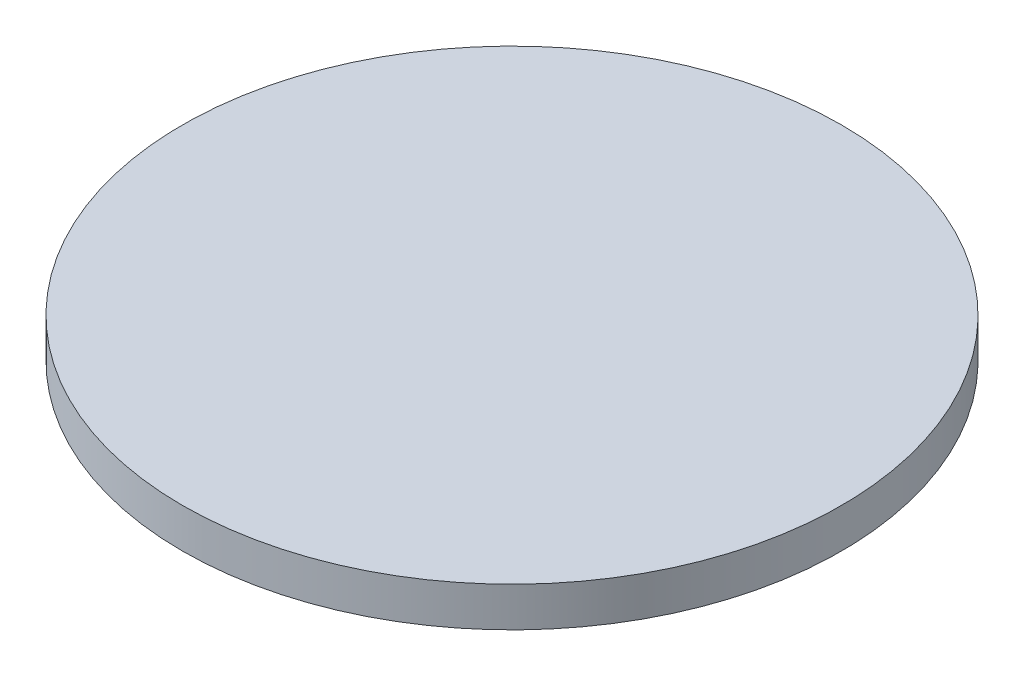
from build123d import *

# Parameters (mm, degrees)
SKETCH1_R           = 25
BOSS_EXTRUDE1_DEPTH = 3


with BuildPart() as part:
    # Sketch1 → Boss-Extrude1 (new body)
    with BuildSketch(Plane(origin=(0, 0, 0), x_dir=(1, 0, 0), z_dir=(0, 1, 0))):
        with Locations(Location((0, 0, 0), (0, 0, 270))):
            Circle(SKETCH1_R)
    extrude(amount=BOSS_EXTRUDE1_DEPTH)


solid = part.part
